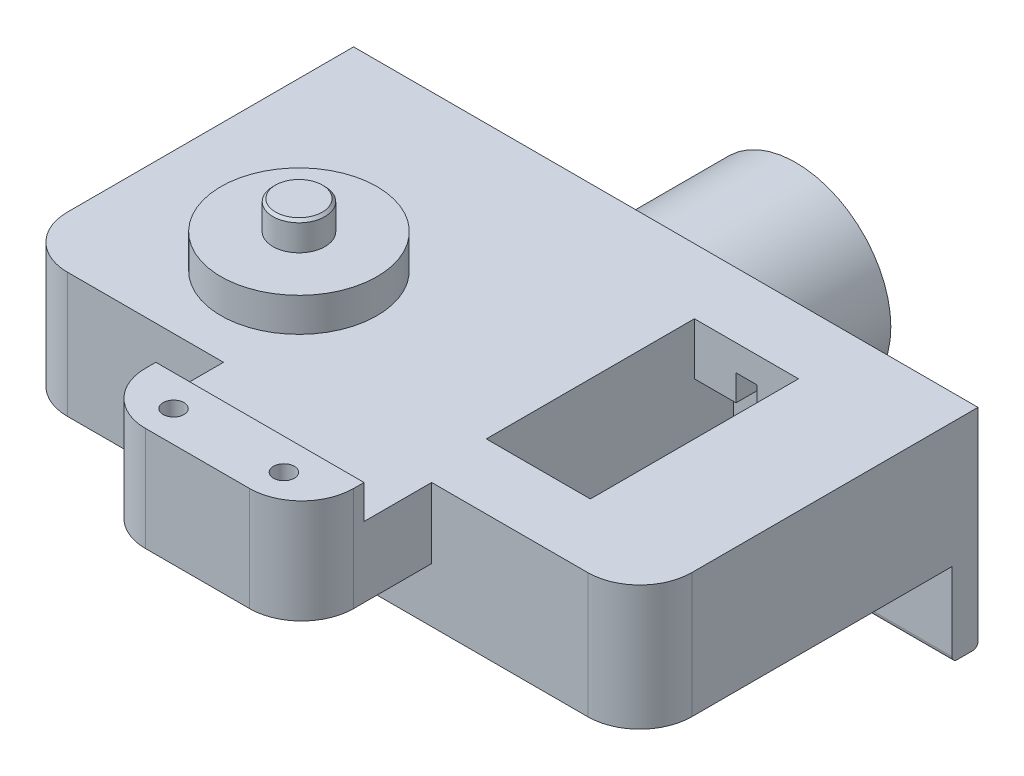
from build123d import *

# Parameters (mm, degrees)
SKETCH_1_R               = 18.25
EXTRUDE_1_DEPTH          = 25
SKETCH_2_R               = 12.5
CUT_EXTRUDE_1_DEPTH      = 25
SKETCH_3_W               = 120
SKETCH_3_H               = 40
EXTRUDE_2_DEPTH          = 65
SKETCH_5_W               = 20
SKETCH_5_H               = 55
CUT_EXTRUDE_2_DEPTH      = 30
SKETCH_6_W               = 20
SKETCH_6_H               = 40
CUT_EXTRUDE_3_DEPTH      = 30
SKETCH_7_W               = 4
SKETCH_7_H               = 55
CUT_EXTRUDE_4_DEPTH      = 5
SKETCH_8_R               = 5
EXTRUDE_4_DEPTH          = 12
CUT_EXTRUDE_5_DEPTH      = 113.800709218
CUT_EXTRUDE_5_DEPTH_BACK = 60
SKETCH_9_W               = 120
SKETCH_9_H               = 16
SKETCH_10_W              = 40
SKETCH_10_H              = 25
EXTRUDE_5_DEPTH          = 13.5
SKETCH_13_R              = 2
CUT_EXTRUDE_6_DEPTH      = 30
SKETCH_14_R              = 15
EXTRUDE_6_DEPTH          = 6.5
EXTRUDE_START            = 6.5
SKETCH_15_W              = 40
SKETCH_15_H              = 12
SKETCH_15_R              = 2
EXTRUDE_7_DEPTH          = 6.5
FILLET_1_R               = 10
FILLET_2_R               = 10
FILLET_3_R               = 1
CHAMFER_1_SIZE           = 0.5


with BuildPart() as part:
    # 草图1 → 凸台-拉伸1 (new body)
    with BuildSketch(Plane.XY):
        Circle(SKETCH_1_R)
    extrude(amount=EXTRUDE_1_DEPTH)

    # 草图2 → 切除-拉伸1 (cut)
    with BuildSketch(Plane.XY.offset(25)):
        Circle(SKETCH_2_R)
    extrude(amount=-CUT_EXTRUDE_1_DEPTH, mode=Mode.SUBTRACT)

    # 草图3 → 凸台-拉伸2 (add)
    with BuildSketch(Plane.XY.offset(25)):
        Rectangle(SKETCH_3_W, SKETCH_3_H)
    extrude(amount=EXTRUDE_2_DEPTH)

    # 草图5 → 切除-拉伸2 (cut)
    with BuildSketch(Plane.XZ.offset(20)):
        with Locations((28, 57.5)):
            Rectangle(SKETCH_5_W, SKETCH_5_H)
    extrude(amount=-CUT_EXTRUDE_2_DEPTH, mode=Mode.SUBTRACT)

    # 草图6 → 切除-拉伸3 (cut)
    with BuildSketch(Plane.XZ.offset(-10)):
        with Locations((28, 57.5)):
            Rectangle(SKETCH_6_W, SKETCH_6_H)
    extrude(amount=-CUT_EXTRUDE_3_DEPTH, mode=Mode.SUBTRACT)

    # 草图7 → 切除-拉伸4 (cut)
    with BuildSketch(Plane.XZ.offset(-10)):
        with Locations((28, 57.5)):
            Rectangle(SKETCH_7_W, SKETCH_7_H)
    extrude(amount=-CUT_EXTRUDE_4_DEPTH, mode=Mode.SUBTRACT)

    # 草图8 → 凸台-拉伸4 (add)
    with BuildSketch(Plane(origin=(0, 20, 0), x_dir=(1, 0, 0), z_dir=(0, 1, 0))):
        with Locations(Location((-28, -67.5, 0), (0, 0, 90))):
            Circle(SKETCH_8_R)
    extrude(amount=EXTRUDE_4_DEPTH)

    # 草图9 → 切除-拉伸5 (cut, two sides: drawn at the far end of the back side and taken through both)
    with BuildSketch(Plane.XY.offset(90).offset(-CUT_EXTRUDE_5_DEPTH_BACK)):
        with Locations((0, -12)):
            Rectangle(SKETCH_9_W, SKETCH_9_H)
    extrude(amount=CUT_EXTRUDE_5_DEPTH + CUT_EXTRUDE_5_DEPTH_BACK, mode=Mode.SUBTRACT)

    # 草图10 → 凸台-拉伸5 (add)
    with BuildSketch(Plane(origin=(0, 20, 0), x_dir=(1, 0, 0), z_dir=(0, 1, 0))):
        with Locations((0, -102.5)):
            Rectangle(SKETCH_10_W, SKETCH_10_H)
    extrude(amount=-EXTRUDE_5_DEPTH)

    # 草图13 → 切除-拉伸6 (cut)
    with BuildSketch(Plane(origin=(0, 20, 0), x_dir=(1, 0, 0), z_dir=(0, 1, 0))):
        with Locations(Location((-10.600287359, -109, 0), (0, 0, 270))):
            Circle(SKETCH_13_R)
        with Locations(Location((10.600287359, -109, 0), (0, 0, 270))):
            Circle(SKETCH_13_R)
    extrude(amount=-CUT_EXTRUDE_6_DEPTH, mode=Mode.SUBTRACT)

    # 草图14 → 凸台-拉伸6 (add)
    with BuildSketch(Plane(origin=(0, 20, 0), x_dir=(1, 0, 0), z_dir=(0, 1, 0))):
        with Locations(Location((-28, -67.5, 0), (0, 0, 90))):
            Circle(SKETCH_14_R)
    extrude(amount=EXTRUDE_6_DEPTH)

    # 草图15 → 凸台-拉伸7 (add)
    with BuildSketch(Plane(origin=(0, 20, 0), x_dir=(1, 0, 0), z_dir=(0, 1, 0)).offset(EXTRUDE_START)):
        with Locations((0, -109)):
            Rectangle(SKETCH_15_W, SKETCH_15_H)
        with Locations(Location((-10.600287359, -109, 0), (0, 0, 270))):
            Circle(SKETCH_15_R, mode=Mode.SUBTRACT)
        with Locations(Location((10.600287359, -109, 0), (0, 0, 270))):
            Circle(SKETCH_15_R, mode=Mode.SUBTRACT)
    extrude(amount=-EXTRUDE_7_DEPTH)

    # 圆角1
    fillet_1_edges = [part.edges().sort_by_distance(p)[0] for p in [
        (-20, 16.5, 115),
        (20, 16.5, 115),
    ]]
    fillet(fillet_1_edges, radius=FILLET_1_R)

    # 圆角2
    fillet_2_edges = [part.edges().sort_by_distance(p)[0] for p in [
        (60, 8, 90),
        (-60, 8, 90),
    ]]
    fillet(fillet_2_edges, radius=FILLET_2_R)

    # 圆角3
    fillet_3_edges = [part.edges().sort_by_distance(p)[0] for p in [
        (0, -20, 25),
        (0, -20, 30),
    ]]
    fillet(fillet_3_edges, radius=FILLET_3_R)

    # 倒角1
    chamfer_1_edges = [part.edges().sort_by_distance(p)[0] for p in [
        (-28, 32, 72.5),
    ]]
    chamfer(chamfer_1_edges, length=CHAMFER_1_SIZE)


solid = part.part
